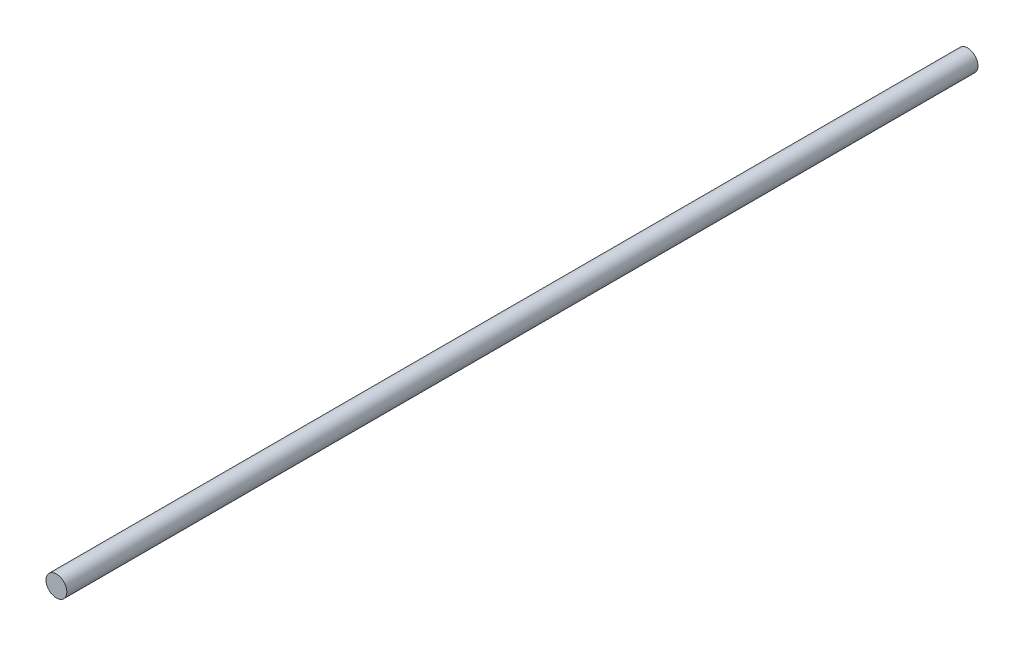
from build123d import *

# Parameters (mm, degrees)
SKETCH_1_R      = 4
EXTRUDE_1_DEPTH = 175


with BuildPart() as part:
    # 草图1 → 凸台-拉伸1 (new, symmetric)
    with BuildSketch(Plane.XY):
        Circle(SKETCH_1_R)
    extrude(amount=EXTRUDE_1_DEPTH, both=True)


solid = part.part
